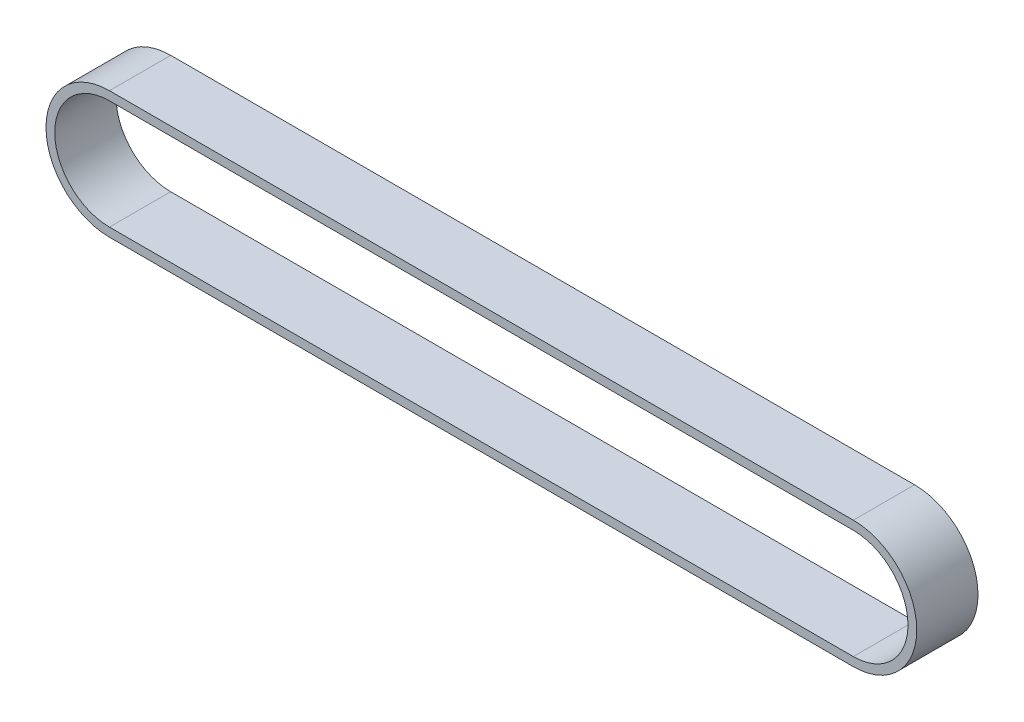
from build123d import *

# Parameters (mm, degrees)
BOSS_EXTRUDE1_DEPTH = 7


with BuildPart() as part:
    # Sketch1 → Boss-Extrude1 (new, symmetric)
    with BuildSketch(Plane.XY):
        with BuildLine():
            Line((-85, 14.5), (85, 14.5))
            ThreePointArc((85, 14.5), (99.5, 0), (85, -14.5))
            Line((85, -14.5), (-85, -14.5))
            ThreePointArc((-85, -14.5), (-99.5, 0), (-85, 14.5))
        make_face()
        with BuildLine():
            Line((-85, 12.5), (85, 12.5))
            ThreePointArc((85, 12.5), (97.5, 0), (85, -12.5))
            Line((85, -12.5), (-85, -12.5))
            ThreePointArc((-85, -12.5), (-97.5, 0), (-85, 12.5))
        make_face(mode=Mode.SUBTRACT)
    extrude(amount=BOSS_EXTRUDE1_DEPTH, both=True)


solid = part.part
